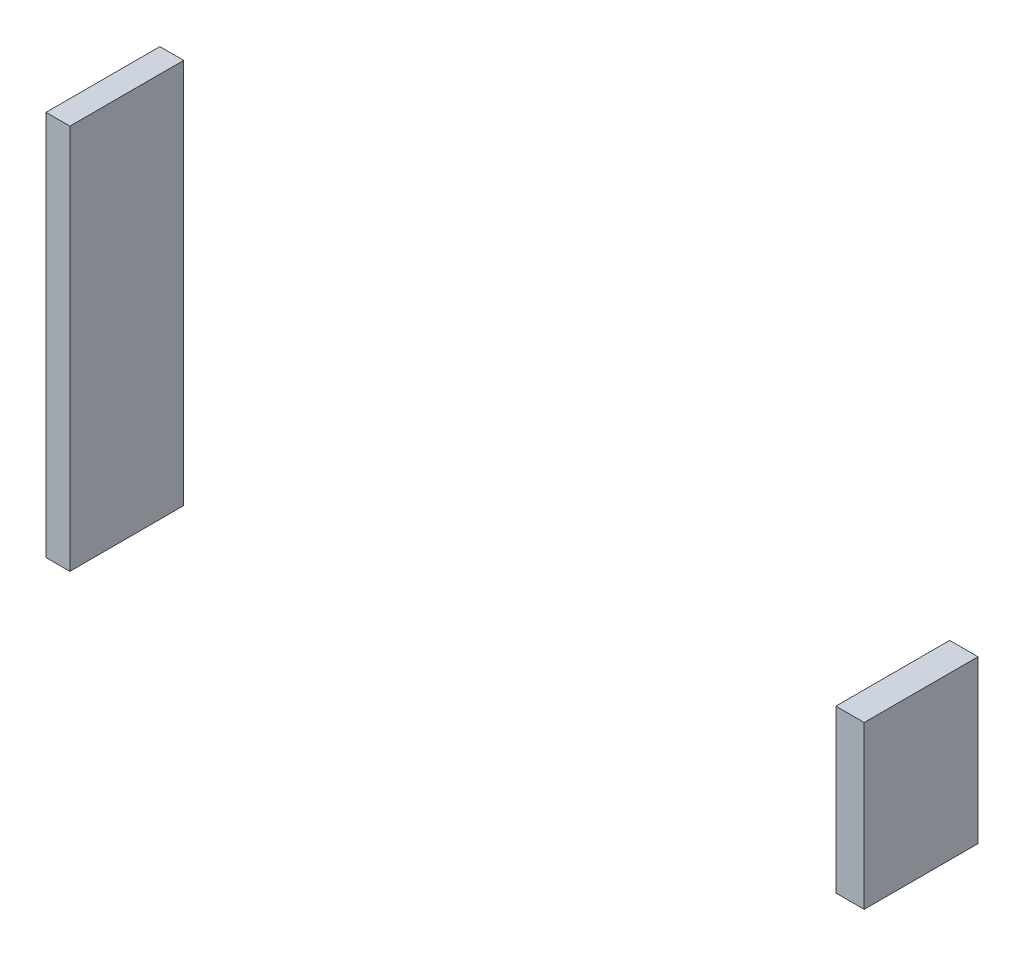
from build123d import *

# Parameters (mm, degrees)
SKETCH1_W             = 2.201459731
SKETCH1_H             = 35.567333793
BOSS_EXTRUDE1_DEPTH   = 10.5
SKETCH1_W_2           = 2.614233432
SKETCH1_H_2           = 14.928648806
BOSS_EXTRUDE1_2_DEPTH = 10.5


with BuildPart() as part:
    # Sketch1 → Boss-Extrude1 (new body)
    with BuildSketch(Plane.XY):
        with Locations((-37.012041743, 0.687956167)):
            Rectangle(SKETCH1_W, SKETCH1_H)
    extrude(amount=BOSS_EXTRUDE1_DEPTH)


with BuildPart() as body_2:
    # Sketch1 → Boss-Extrude1 2 (new body)
    with BuildSketch(Plane.XY):
        with Locations((36.04890311, 0)):
            Rectangle(SKETCH1_W_2, SKETCH1_H_2)
    extrude(amount=BOSS_EXTRUDE1_2_DEPTH)


solid = Compound([part.part, body_2.part])
